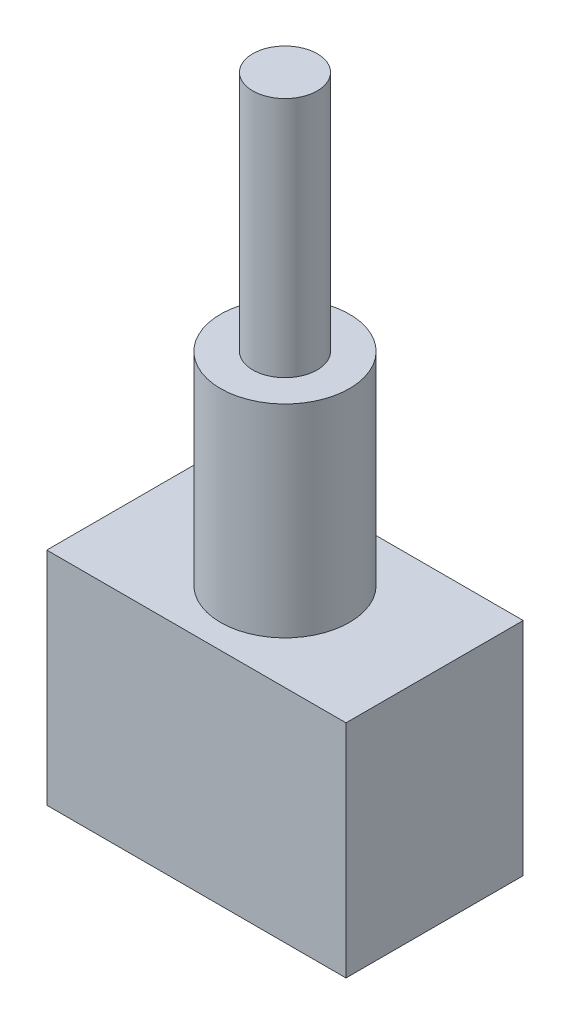
from build123d import *

# Parameters (mm, degrees)
ESBO_O2_W                = 13
ESBO_O2_H                = 9.6
RESSALTO_EXTRUS_O1_DEPTH = 7.7
ESBO_O3_R                = 2.8
RESSALTO_EXTRUS_O2_DEPTH = 8.8
ESBO_O5_R                = 1.4
RESSALTO_EXTRUS_O3_DEPTH = 10.5


with BuildPart() as part:
    # Esboço2 → Ressalto-extrusão1 (new body)
    with BuildSketch(Plane.XY):
        with Locations((6.5, 4.8)):
            Rectangle(ESBO_O2_W, ESBO_O2_H)
    extrude(amount=RESSALTO_EXTRUS_O1_DEPTH)

    # Esboço3 → Ressalto-extrusão2 (add)
    with BuildSketch(Plane(origin=(0, 9.6, 0), x_dir=(1, 0, 0), z_dir=(0, 1, 0))):
        with Locations(Location((6.5, -3.85, 0), (0, 0, 270))):
            Circle(ESBO_O3_R)
    extrude(amount=RESSALTO_EXTRUS_O2_DEPTH)

    # Esboço5 → Ressalto-extrusão3 (add)
    with BuildSketch(Plane(origin=(0, 18.4, 0), x_dir=(1, 0, 0), z_dir=(0, 1, 0))):
        with Locations(Location((6.5, -3.85, 0), (0, 0, 90))):
            Circle(ESBO_O5_R)
    extrude(amount=RESSALTO_EXTRUS_O3_DEPTH)


solid = part.part
